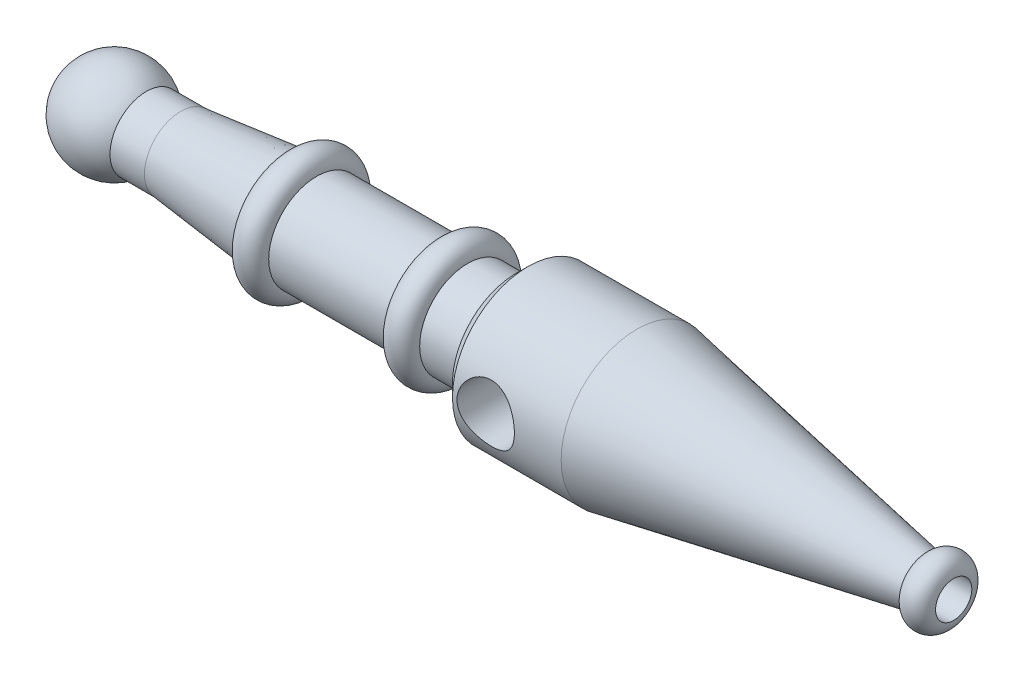
from build123d import *

# Parameters (mm, degrees)
CHAMFER1_SIZE           = 2
CUT_EXTRUDE1_DEPTH      = 141.119591778
CUT_EXTRUDE1_DEPTH_BACK = 141.119591778
SKETCH2_R               = 4.75


with BuildPart() as part:
    # Sketch1 → Revolve1 (revolve)
    with BuildSketch(Plane(origin=(0, 0, 0), x_dir=(1, 0, 0), z_dir=(0, 1, 0)), mode=Mode.PRIVATE) as revolve1_sk:
        with BuildLine():
            Line((5.291502622, 6), (11, 6))
            Line((11, 6), (28.5, 7.927014812))
            ThreePointArc((28.5, 7.927014812), (31, 10.427014812), (33.5, 7.927014812))
            Line((33.5, 7.927014812), (53.5, 7.927014812))
            ThreePointArc((53.5, 7.927014812), (56, 10.427014812), (58.5, 7.927014812))
            Line((58.5, 7.927014812), (66.5, 7.927014812))
            Line((66.5, 7.927014812), (66.5, 12.5))
            Line((66.5, 12.5), (86.5, 12.5))
            Line((86.5, 12.5), (134.158528017, 3.876075883))
            ThreePointArc((134.158528017, 3.876075883), (136.945151683, 5.460048776), (139, 3))
            Line((139, 3), (0, 3))
            Line((0, 3), (0, 0))
            Line((0, 0), (-8, 0))
            ThreePointArc((-8, 0), (-3.291502622, 7.291502622), (5.291502622, 6))
        make_face()
    revolve(revolve1_sk.sketch.rotate(Axis((0, 0, 0), (1, 0, 0)), 180), axis=Axis((0, 0, 0), (1, 0, 0)))

    # Chamfer1
    chamfer1_edges = [part.edges().sort_by_distance(p)[0] for p in [
        (66.5, 0, -12.5),
    ]]
    chamfer(chamfer1_edges, length=CHAMFER1_SIZE)

    # Sketch2 → Cut-Extrude1 (cut, two sides: drawn at the far end of the back side and taken through both)
    with BuildSketch(Plane.XY.offset(-CUT_EXTRUDE1_DEPTH_BACK)):
        with Locations((74, 0)):
            Circle(SKETCH2_R)
    extrude(amount=CUT_EXTRUDE1_DEPTH + CUT_EXTRUDE1_DEPTH_BACK, mode=Mode.SUBTRACT)


solid = part.part
